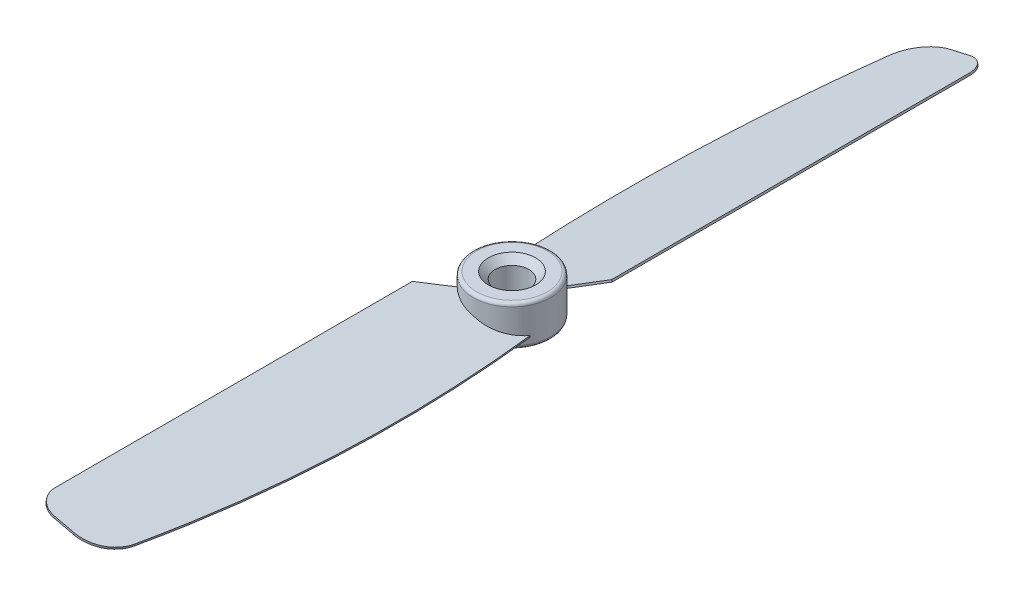
from build123d import *

# Parameters (mm, degrees)
SKETCH1_R           = 5.75
BOSS_EXTRUDE1_DEPTH = 3
BOSS_EXTRUDE2_DEPTH = 0.15
CIRPATTERN1_COUNT   = 2
SKETCH4_R           = 2.5
CUT_EXTRUDE1_DEPTH  = 65.203765671
FILLET1_R           = 0.5
CHAMFER1_SIZE       = 1
CHAMFER2_SIZE       = 1


with BuildPart() as part:
    # Sketch1 → Boss-Extrude1 (new, symmetric)
    with BuildSketch(Plane(origin=(0, 0, 0), x_dir=(1, 0, 0), z_dir=(0, 1, 0))):
        with Locations(Location((0, 0, 0), (0, 0, 270))):
            Circle(SKETCH1_R)
    extrude(amount=BOSS_EXTRUDE1_DEPTH, both=True)

    # Sketch3 → Boss-Extrude2 (add, symmetric)
    with BuildSketch(Plane(origin=(0, 0, 0), x_dir=(0.9743700647852352, -0.22495105434386534, 0), z_dir=(-0.22495105434386534, -0.9743700647852352, 0))):
        with BuildLine():
            Line((-3.652357561, 3.652357561), (-7.49829587, 7.49829587))
            Line((-7.49829587, 7.49829587), (-7.49829587, 60.5))
            ThreePointArc((-7.49829587, 60.5), (-6.619616214, 62.621320344), (-4.49829587, 63.5))
            Line((-4.49829587, 63.5), (-1.464719741, 63.5))
            ThreePointArc((-1.464719741, 63.5), (1.755916544, 62.324591732), (3.462327822, 59.351000768))
            add(Edge.make_bspline(
                [(5.579389338, 2.779553643), (7.404721725, 21.734683746), (6.697564401, 40.619919544), (3.462327822, 59.351000768)],
                knots=[0, 0, 0, 0, 0.931210361, 0.931210361, 0.931210361, 0.931210361], degree=3))
            add(Edge.make_bspline(
                [(5.579389338, 2.779553643), (1.589885299, 10.194259474), (-3.652357561, 3.652357561)],
                knots=[5.216924211, 5.216924211, 5.216924211, 7.165723747, 7.165723747, 7.165723747], degree=2, weights=[1, 0.561664766, 1]))
        make_face()
    boss_extrude2 = extrude(amount=BOSS_EXTRUDE2_DEPTH, both=True)

    # CirPattern1: Boss-Extrude2 ×2 about axis
    cirpattern1_axis = Axis((0, 3, 0), (0, -1, 0))
    for i in range(1, CIRPATTERN1_COUNT):
        add(boss_extrude2.rotate(cirpattern1_axis, i * 360 / CIRPATTERN1_COUNT))

    # Sketch4 → Cut-Extrude1 (cut, through all)
    with BuildSketch(Plane.XZ.offset(3)):
        with Locations(Location((0, 0, 0), (0, 0, 270))):
            Circle(SKETCH4_R)
    extrude(amount=-CUT_EXTRUDE1_DEPTH, mode=Mode.SUBTRACT)

    # Fillet1
    fillet1_edges = [part.edges().sort_by_distance(p)[0] for p in [
        (0, -3, -5.75),
        (0, 3, -5.75),
    ]]
    fillet(fillet1_edges, radius=FILLET1_R)

    # Chamfer1
    chamfer1_edges = [part.edges().sort_by_distance(p)[0] for p in [
        (0, -3, 2.5),
    ]]
    chamfer(chamfer1_edges, length=CHAMFER1_SIZE)

    # Chamfer2
    chamfer2_edges = [part.edges().sort_by_distance(p)[0] for p in [
        (0, 3, 2.5),
    ]]
    chamfer(chamfer2_edges, length=CHAMFER2_SIZE)


solid = part.part
